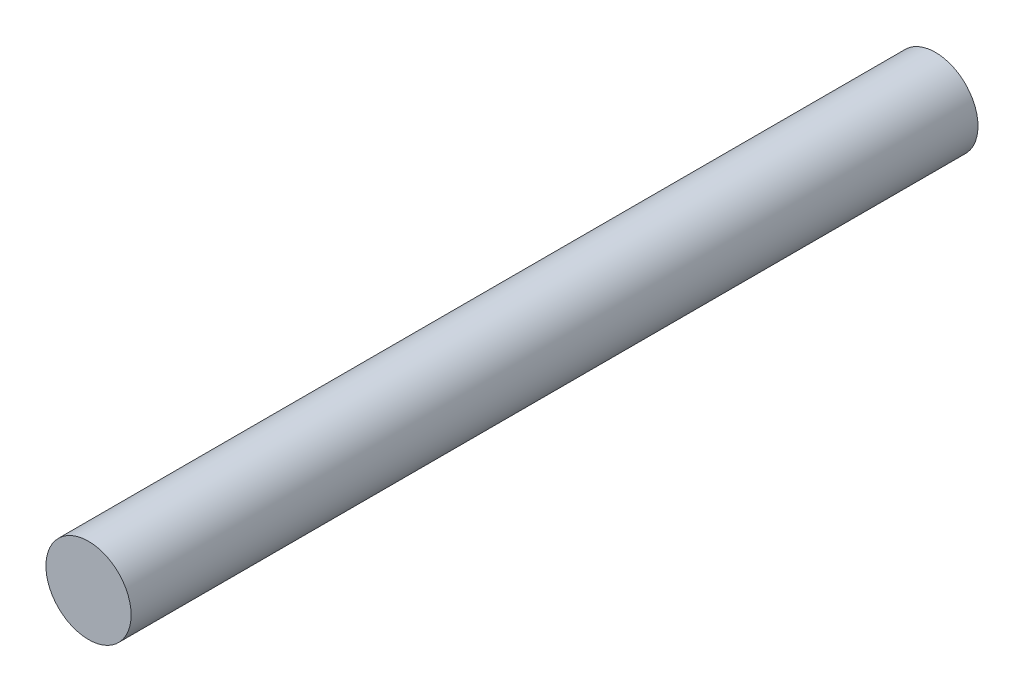
from build123d import *

# Parameters (mm, degrees)
SKETCH1_R           = 3.175
BOSS_EXTRUDE1_DEPTH = 63.1346


with BuildPart() as part:
    # Sketch1 → Boss-Extrude1 (new body)
    with BuildSketch(Plane.XY):
        Circle(SKETCH1_R)
    extrude(amount=BOSS_EXTRUDE1_DEPTH)


solid = part.part
